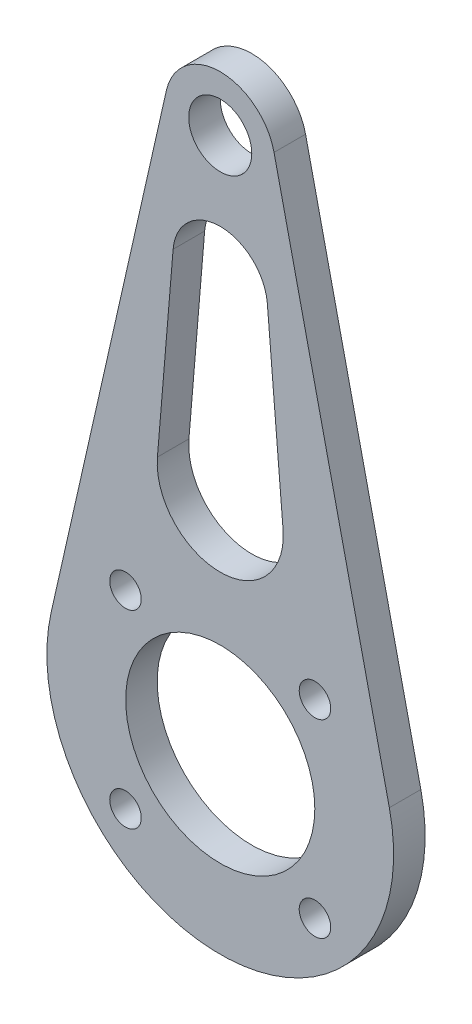
from build123d import *

# Parameters (mm, degrees)
SKETCH_1_R               = 6
SKETCH_1_R_2             = 2
EXTRUDE_1_DEPTH          = 2
SKETCH_2_R               = 1
CUT_EXTRUDE_2_DEPTH      = 28.256856644
PATTERN_CIRCULAR_1_COUNT = 4


with BuildPart() as part:
    # 草图1 → 凸台-拉伸1 (new body)
    with BuildSketch(Plane.XY):
        with BuildLine():
            Line((-3.918715904, 21.143360332), (-11.23396858, -11.202227903))
            ThreePointArc((-11.23396858, -11.202227903), (-0.504931322, -24.628698491), (10.224105936, -11.202227903))
            Line((10.224105936, -11.202227903), (2.90885326, 21.143360332))
            ThreePointArc((2.90885326, 21.143360332), (-0.504931322, 23.871301509), (-3.918715904, 21.143360332))
        make_face()
        with Locations((-0.504931322, -13.628698491)):
            Circle(SKETCH_1_R, mode=Mode.SUBTRACT)
        with Locations((-0.504931322, 20.371301509)):
            Circle(SKETCH_1_R_2, mode=Mode.SUBTRACT)
        with BuildLine():
            Line((-3.494496508, 12.621301509), (-4.491018236, 0.704634842))
            ThreePointArc((-4.491018236, 0.704634842), (-0.504931322, -3.628698491), (3.481155593, 0.704634842))
            Line((3.481155593, 0.704634842), (2.484633864, 12.621301509))
            ThreePointArc((2.484633864, 12.621301509), (-0.504931322, 15.371301509), (-3.494496508, 12.621301509))
        make_face(mode=Mode.SUBTRACT)
    extrude(amount=EXTRUDE_1_DEPTH)

    # 草图2 → 切除-拉伸2 (cut, through all)
    with BuildSketch(Plane.XY.offset(2)):
        with Locations((5.505476318, -19.639106131)):
            Circle(SKETCH_2_R)
    cut_extrude_2 = extrude(amount=-CUT_EXTRUDE_2_DEPTH, mode=Mode.SUBTRACT)

    # 阵列(圆周)1: 切除-拉伸2 ×4 about axis
    pattern_circular_1_axis = Axis((-0.504931322, -13.628698491, 0), (0, 0, 1))
    for i in range(1, PATTERN_CIRCULAR_1_COUNT):
        add(cut_extrude_2.rotate(pattern_circular_1_axis, i * 360 / PATTERN_CIRCULAR_1_COUNT), mode=Mode.SUBTRACT)


solid = part.part
